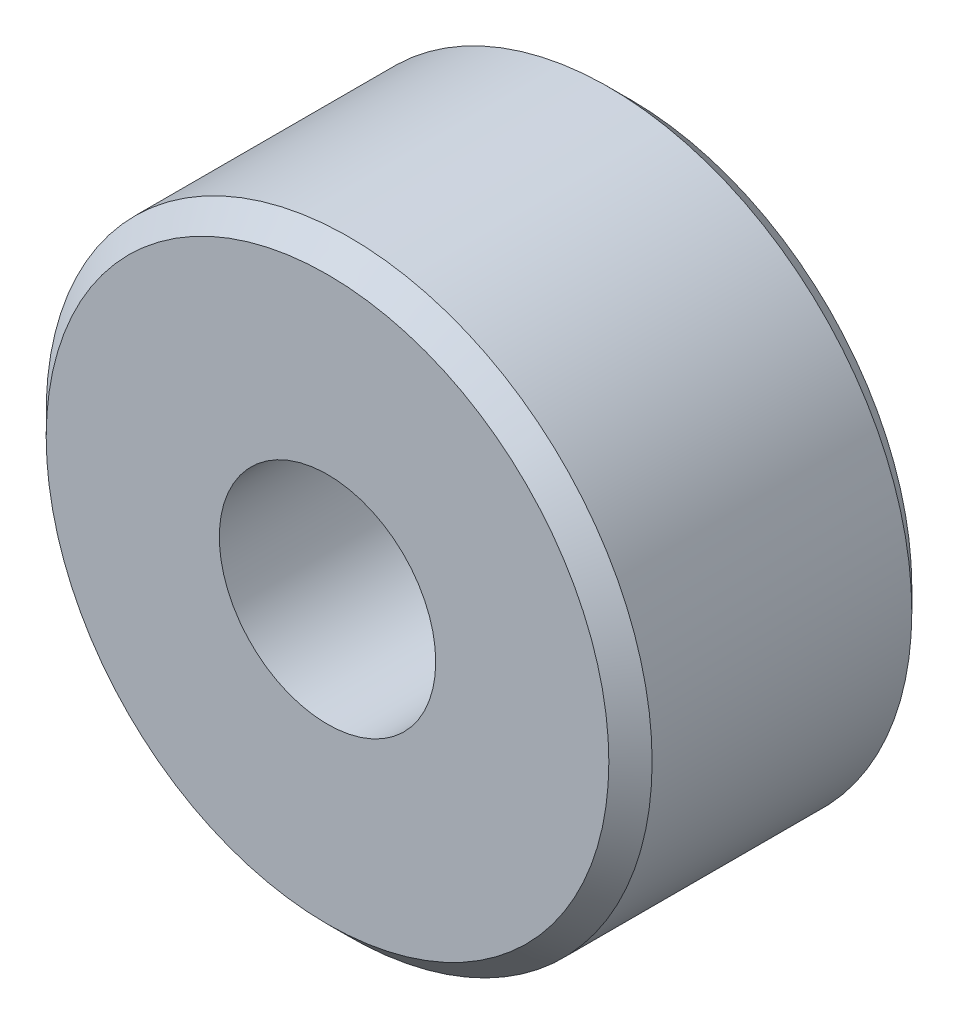
from build123d import *

# Parameters (mm, degrees)
SKETCH1_R           = 1.4
SKETCH1_R_2         = 0.5
BOSS_EXTRUDE1_DEPTH = 1.4
CHAMFER1_SIZE       = 0.1


with BuildPart() as part:
    # Sketch1 → Boss-Extrude1 (new body)
    with BuildSketch(Plane.XY):
        Circle(SKETCH1_R)
        Circle(SKETCH1_R_2, mode=Mode.SUBTRACT)
    extrude(amount=BOSS_EXTRUDE1_DEPTH)

    # Chamfer1
    chamfer1_edges = [part.edges().sort_by_distance(p)[0] for p in [
        (-1.4, 0, 0),
        (-1.4, 0, 1.4),
        (-0.5, 0, 0),
    ]]
    chamfer(chamfer1_edges, length=CHAMFER1_SIZE)


solid = part.part
